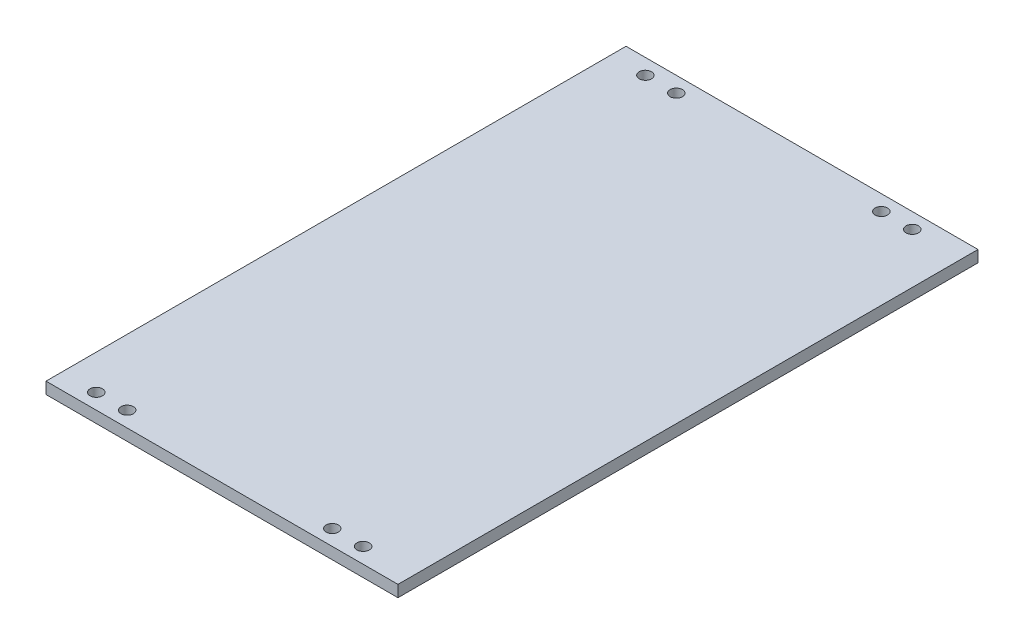
from build123d import *

# Parameters (mm, degrees)
SKETCH_1_W      = 91.020470937
SKETCH_1_H      = 150
SKETCH_1_R      = 1.6
EXTRUDE_1_DEPTH = 3


with BuildPart() as part:
    # 草图1 → 凸台-拉伸1 (new body)
    with BuildSketch(Plane.XZ.offset(-2.259155248)):
        with Locations((19.694725206, 27.888283405)):
            Rectangle(SKETCH_1_W, SKETCH_1_H)
        with Locations(Location((44.204960674, -43.111716595, 0), (0, 0, 270))):
            Circle(SKETCH_1_R, mode=Mode.SUBTRACT)
        with Locations(Location((52.204960674, -43.111716595, 0), (0, 0, 270))):
            Circle(SKETCH_1_R, mode=Mode.SUBTRACT)
        with Locations(Location((52.204960674, 98.888283405, 0), (0, 0, 90))):
            Circle(SKETCH_1_R, mode=Mode.SUBTRACT)
        with Locations(Location((44.204960674, 98.888283405, 0), (0, 0, 90))):
            Circle(SKETCH_1_R, mode=Mode.SUBTRACT)
        with Locations(Location((-16.815510263, -43.111716595, 0), (0, 0, 270))):
            Circle(SKETCH_1_R, mode=Mode.SUBTRACT)
        with Locations(Location((-8.815510263, -43.111716595, 0), (0, 0, 270))):
            Circle(SKETCH_1_R, mode=Mode.SUBTRACT)
        with Locations(Location((-8.815510263, 98.888283405, 0), (0, 0, 90))):
            Circle(SKETCH_1_R, mode=Mode.SUBTRACT)
        with Locations(Location((-16.815510263, 98.888283405, 0), (0, 0, 90))):
            Circle(SKETCH_1_R, mode=Mode.SUBTRACT)
    extrude(amount=-EXTRUDE_1_DEPTH)


solid = part.part
